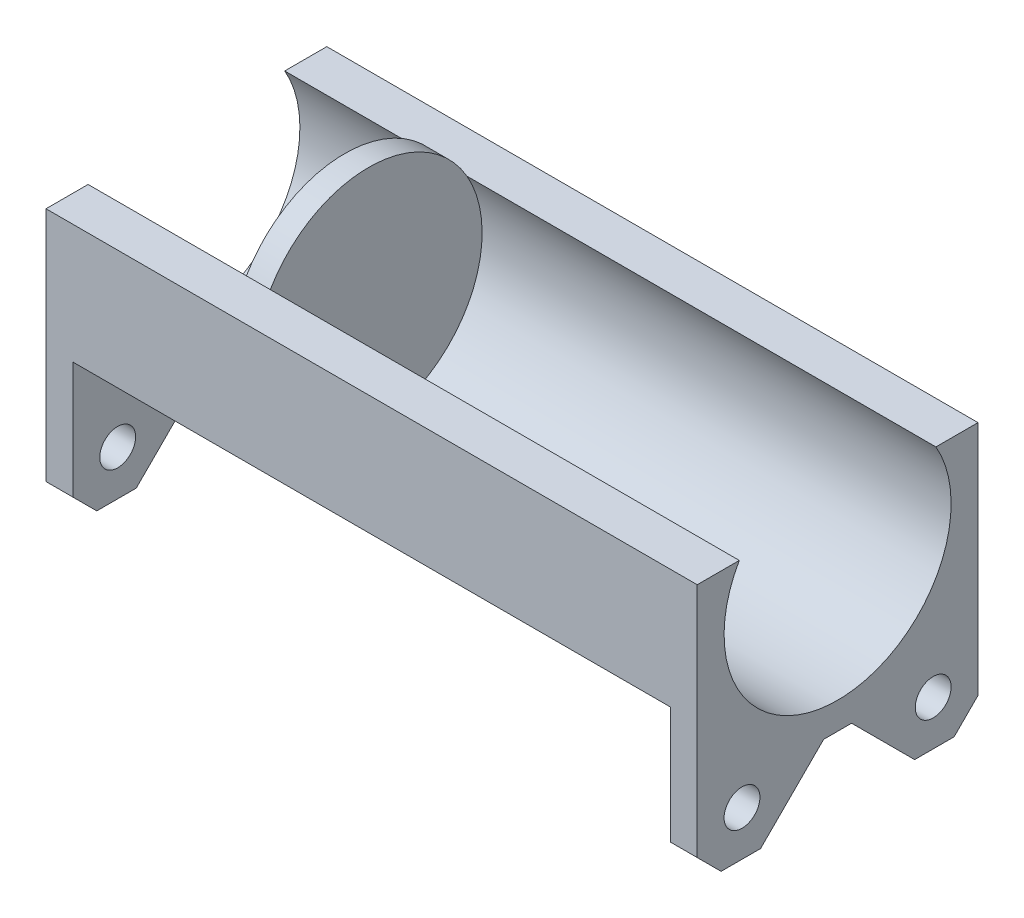
from build123d import *

# Parameters (mm, degrees)
BOSS_EXTRUDE1_START = -24
SKETCH4_R           = 19
BOSS_EXTRUDE1_DEPTH = 4
SKETCH5_R           = 3
BOSS_EXTRUDE2_DEPTH = 54.5
CUT_EXTRUDE1_DEPTH  = 50
CHAMFER1_SIZE       = 4


with BuildPart() as part:
    # Sketch4 → Boss-Extrude1 (new body)
    with BuildSketch(Plane(origin=(0, 0, 0), x_dir=(0, 0, -1), z_dir=(1, 0, 0)).offset(BOSS_EXTRUDE1_START)):
        Circle(SKETCH4_R)
    extrude(amount=-BOSS_EXTRUDE1_DEPTH)

    # Sketch5 → Boss-Extrude2 (add, symmetric)
    with BuildSketch(Plane(origin=(0, 0, 0), x_dir=(0, 0, -1), z_dir=(1, 0, 0))):
        with BuildLine():
            Line((16.454482672, 9.5), (23.5, 9.5))
            Line((23.5, 9.5), (23.5, -34.051836095))
            Line((23.5, -34.051836095), (12.893398282, -34.051836095))
            Line((12.893398282, -34.051836095), (2.341562187, -23.5))
            Line((2.341562187, -23.5), (-2.341562187, -23.5))
            Line((-2.341562187, -23.5), (-12.893398282, -34.051836095))
            Line((-12.893398282, -34.051836095), (-23.5, -34.051836095))
            Line((-23.5, -34.051836095), (-23.5, 9.5))
            Line((-23.5, 9.5), (-16.454482672, 9.5))
            ThreePointArc((-16.454482672, 9.5), (0, -19), (16.454482672, 9.5))
        make_face()
        with Locations((16, -26.551836095)):
            Circle(SKETCH5_R, mode=Mode.SUBTRACT)
        with Locations(Location((-16, -26.551836095, 0), (0, 0, 180))):
            Circle(SKETCH5_R, mode=Mode.SUBTRACT)
    extrude(amount=BOSS_EXTRUDE2_DEPTH, both=True)

    # Sketch6 → Cut-Extrude1 (cut, symmetric)
    with BuildSketch(Plane(origin=(0, 0, 0), x_dir=(0, 0, -1), z_dir=(1, 0, 0))):
        Polygon((2.341562187, -23.5), (7.969107928, -23.5), (23.5, -10.468034191), (23.5, -34.051836095), (-23.5, -34.051836095), (-23.5, -10.468034191), (-7.969107928, -23.5), (-2.341562187, -23.5), align=None)
    extrude(amount=CUT_EXTRUDE1_DEPTH, both=True, mode=Mode.SUBTRACT)

    # Chamfer1
    chamfer1_edges = [part.edges().sort_by_distance(p)[0] for p in [
        (52.25, -34.051836095, 23.5),
        (52.25, -34.051836095, -23.5),
        (-52.25, -34.051836095, -23.5),
        (-52.25, -34.051836095, 23.5),
    ]]
    chamfer(chamfer1_edges, length=CHAMFER1_SIZE)


solid = part.part
